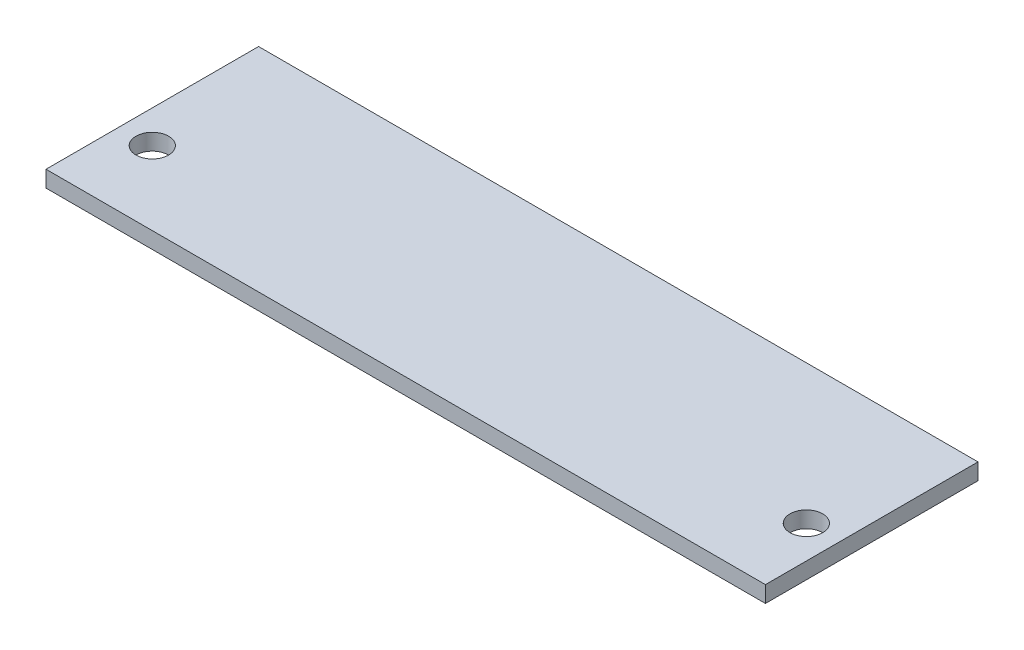
from build123d import *

# Parameters (mm, degrees)
SKETCH2_W           = 279.4
SKETCH2_H           = 82.55
SKETCH2_R           = 6.35
BOSS_EXTRUDE1_DEPTH = 6.35


with BuildPart() as part:
    # Sketch2 → Boss-Extrude1 (new body)
    with BuildSketch(Plane(origin=(0, 0, 0), x_dir=(1, 0, 0), z_dir=(0, 1, 0))):
        with Locations((139.7, -41.275)):
            Rectangle(SKETCH2_W, SKETCH2_H)
        with Locations(Location((12.7, -53.97321438, 0), (0, 0, 270))):
            Circle(SKETCH2_R, mode=Mode.SUBTRACT)
        with Locations(Location((266.7, -53.97321438, 0), (0, 0, 270))):
            Circle(SKETCH2_R, mode=Mode.SUBTRACT)
    extrude(amount=BOSS_EXTRUDE1_DEPTH)


solid = part.part
